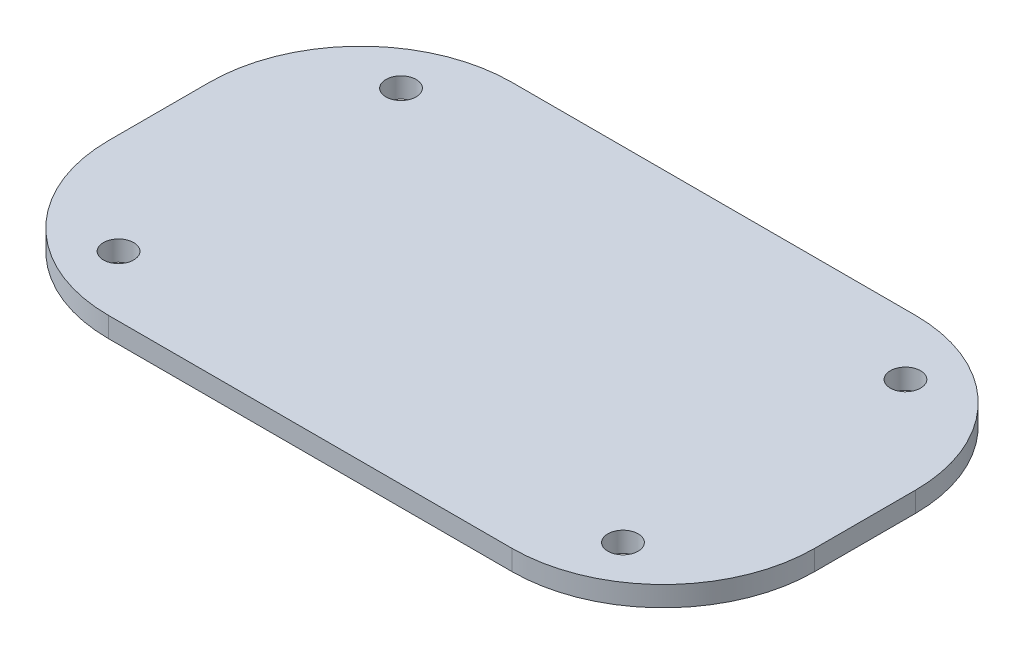
from build123d import *

# Parameters (mm, degrees)
SKETCH_1_W          = 70
SKETCH_1_H          = 40
EXTRUDE_1_DEPTH     = 2
FILLET_1_R          = 15
SKETCH_2_R          = 1.5
CUT_EXTRUDE_1_DEPTH = 41.360872141


with BuildPart() as part:
    # 草图1 → 凸台-拉伸1 (new body)
    with BuildSketch(Plane(origin=(0, 0, 0), x_dir=(1, 0, 0), z_dir=(0, 1, 0))):
        Rectangle(SKETCH_1_W, SKETCH_1_H)
    extrude(amount=EXTRUDE_1_DEPTH)

    # 圆角1
    fillet_1_edges = [part.edges().sort_by_distance(p)[0] for p in [
        (35, 1, 20),
        (-35, 1, 20),
        (-35, 1, -20),
        (35, 1, -20),
    ]]
    fillet(fillet_1_edges, radius=FILLET_1_R)

    # 草图2 → 切除-拉伸1 (cut, through all)
    with BuildSketch(Plane(origin=(0, 2, 0), x_dir=(1, 0, 0), z_dir=(0, 1, 0))):
        with Locations(Location((-25, 14, 0), (0, 0, 270))):
            Circle(SKETCH_2_R)
        with Locations(Location((25, 14, 0), (0, 0, 270))):
            Circle(SKETCH_2_R)
        with Locations(Location((25, -14, 0), (0, 0, 270))):
            Circle(SKETCH_2_R)
        with Locations(Location((-25, -14, 0), (0, 0, 270))):
            Circle(SKETCH_2_R)
    extrude(amount=-CUT_EXTRUDE_1_DEPTH, mode=Mode.SUBTRACT)


solid = part.part
